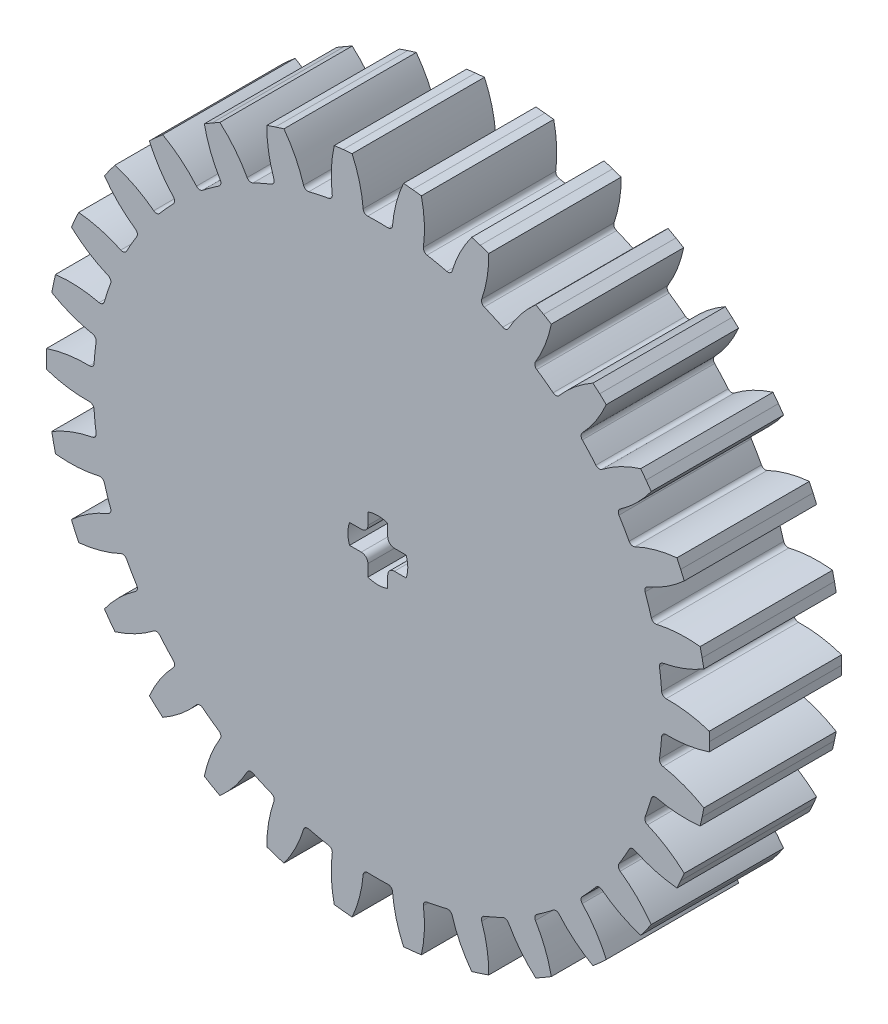
from build123d import *

# Parameters (mm, degrees)
BOSS_EXTRUDE1_DEPTH      = 10
FILLET1_R                = 0.3325
CIRPATTERN1_COUNT        = 30
FILLET1_OF_CIRPATTERN1_R = 0.3325
CUT_EXTRUDE1_REACH       = 38.759


with BuildPart() as part:
    # Sketch1 → Boss-Extrude1 (new body)
    with BuildSketch(Plane.XY):
        with BuildLine():
            Line((25.040834221, 0.677585061), (25.05, 0))
            Line((25.05, 0), (25.040834221, -0.677585061))
            ThreePointArc((25.040834221, -0.677585061), (23.273874213, -1.0893045), (21.461049387, -1.162288888))
            ThreePointArc((21.461049387, -1.162288888), (21.424766078, -1.704979397), (21.374761836, -2.246577997))
            Line((21.374761836, -2.246577997), (0, 0))
            Line((0, 0), (21.374761836, 2.246577997))
            ThreePointArc((21.374761836, 2.246577997), (21.424766078, 1.704979397), (21.461049387, 1.162288888))
            ThreePointArc((21.461049387, 1.162288888), (23.273874213, 1.0893045), (25.040834221, 0.677585061))
        make_face()
    boss_extrude1 = extrude(amount=BOSS_EXTRUDE1_DEPTH)

    # Fillet1
    fillet1_edges = [part.edges().sort_by_distance(p)[0] for p in [
        (21.461049387, 1.162288888, 5),
        (21.461049387, -1.162288888, 5),
    ]]
    fillet(fillet1_edges, radius=FILLET1_R)

    # CirPattern1: Boss-Extrude1 ×30 about axis
    cirpattern1_axis = Axis((0, 0, 0), (0, 0, 1))
    for i in range(1, CIRPATTERN1_COUNT):
        add(boss_extrude1.rotate(cirpattern1_axis, i * 360 / CIRPATTERN1_COUNT))

    # Fillet1 of CirPattern1
    fillet1_of_cirpattern1_edges = [part.edges().sort_by_distance(p)[0] for p in [
        (20.750420519, 5.598893152, 5),
        (21.233727415, 3.325112978, 5),
        (19.132898703, 9.790798919, 5),
        (20.078389664, 7.66719145, 5),
        (16.679177404, 13.554799791, 5),
        (18.045529939, 11.674176866, 5),
        (13.496496017, 16.72639087, 5),
        (15.223993962, 15.170944733, 5),
        (9.72395299, 19.166958405, 5),
        (11.737096397, 18.004669517, 5),
        (5.526426557, 20.769837885, 5),
        (7.737231399, 20.051503847, 5),
        (1.087368765, 21.464975784, 5),
        (3.39921226, 21.221991242, 5),
        (-3.39921226, 21.221991242, 5),
        (-1.087368765, 21.464975784, 5),
        (-7.737231399, 20.051503847, 5),
        (-5.526426557, 20.769837885, 5),
        (-11.737096397, 18.004669517, 5),
        (-9.72395299, 19.166958405, 5),
        (-15.223993962, 15.170944733, 5),
        (-13.496496017, 16.72639087, 5),
        (-18.045529939, 11.674176866, 5),
        (-16.679177404, 13.554799791, 5),
        (-20.078389664, 7.66719145, 5),
        (-19.132898703, 9.790798919, 5),
        (-21.233727415, 3.325112978, 5),
        (-20.750420519, 5.598893152, 5),
        (-21.461049387, -1.162288888, 5),
        (-21.461049387, 1.162288888, 5),
        (-20.750420519, -5.598893152, 5),
        (-21.233727415, -3.325112978, 5),
        (-19.132898703, -9.790798919, 5),
        (-20.078389664, -7.66719145, 5),
        (-16.679177404, -13.554799791, 5),
        (-18.045529939, -11.674176866, 5),
        (-13.496496017, -16.72639087, 5),
        (-15.223993962, -15.170944733, 5),
        (-9.72395299, -19.166958405, 5),
        (-11.737096397, -18.004669517, 5),
        (-5.526426557, -20.769837885, 5),
        (-7.737231399, -20.051503847, 5),
        (-1.087368765, -21.464975784, 5),
        (-3.39921226, -21.221991242, 5),
        (3.39921226, -21.221991242, 5),
        (1.087368765, -21.464975784, 5),
        (7.737231399, -20.051503847, 5),
        (5.526426557, -20.769837885, 5),
        (11.737096397, -18.004669517, 5),
        (9.72395299, -19.166958405, 5),
        (15.223993962, -15.170944733, 5),
        (13.496496017, -16.72639087, 5),
        (18.045529939, -11.674176866, 5),
        (16.679177404, -13.554799791, 5),
        (20.078389664, -7.66719145, 5),
        (19.132898703, -9.790798919, 5),
        (21.233727415, -3.325112978, 5),
        (20.750420519, -5.598893152, 5),
    ]]
    fillet(fillet1_of_cirpattern1_edges, radius=FILLET1_OF_CIRPATTERN1_R)

    # Sketch2 → Cut-Extrude1 (cut, up to next)
    with BuildSketch(Plane(origin=(0, 0, 0), x_dir=(-1, 0, 0), z_dir=(0, 0, -1)), mode=Mode.PRIVATE) as cut_extrude1_sk1:
        with BuildLine():
            Line((0.75, 2.137223666), (0.75, 1.25))
            ThreePointArc((0.75, 1.25), (0.896446609, 0.896446609), (1.25, 0.75))
            Line((1.25, 0.75), (2.137223666, 0.75))
            ThreePointArc((2.137223666, 0.75), (2.265, 0), (2.137223666, -0.75))
            Line((2.137223666, -0.75), (1.25, -0.75))
            ThreePointArc((1.25, -0.75), (0.896446609, -0.896446609), (0.75, -1.25))
            Line((0.75, -1.25), (0.75, -2.137223666))
            ThreePointArc((0.75, -2.137223666), (0, -2.265), (-0.75, -2.137223666))
            Line((-0.75, -2.137223666), (-0.75, -1.25))
            ThreePointArc((-0.75, -1.25), (-0.896446609, -0.896446609), (-1.25, -0.75))
            Line((-1.25, -0.75), (-2.137223666, -0.75))
            ThreePointArc((-2.137223666, -0.75), (-2.265, 0), (-2.137223666, 0.75))
            Line((-2.137223666, 0.75), (-1.25, 0.75))
            ThreePointArc((-1.25, 0.75), (-0.896446609, 0.896446609), (-0.75, 1.25))
            Line((-0.75, 1.25), (-0.75, 2.137223666))
            ThreePointArc((-0.75, 2.137223666), (0, 2.265), (0.75, 2.137223666))
        make_face()
    cut_extrude1_tool1 = extrude(cut_extrude1_sk1.sketch, amount=-CUT_EXTRUDE1_REACH, mode=Mode.PRIVATE) & part.part
    add(cut_extrude1_tool1.solids().sort_by_distance((0, 0, 0))[0], mode=Mode.SUBTRACT)


solid = part.part
